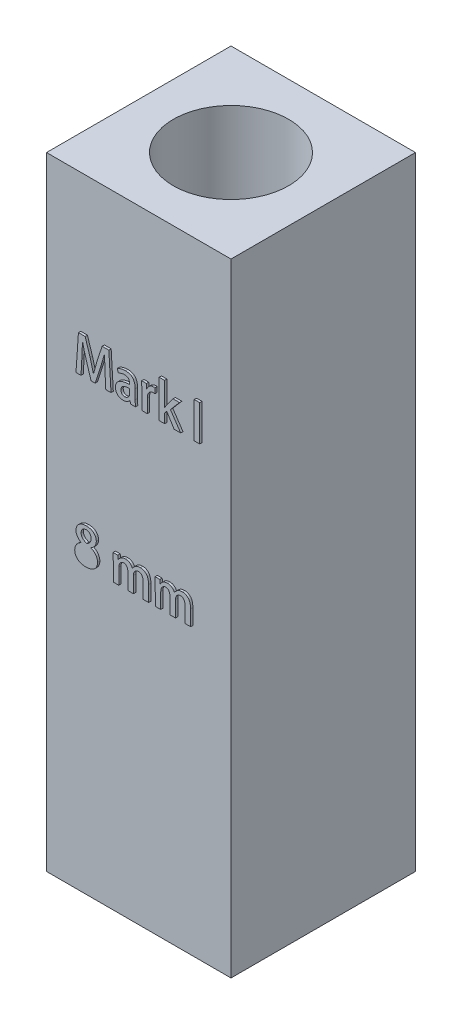
from build123d import *

# Parameters (mm, degrees)
CROQUIS1_W              = 8
CROQUIS1_H              = 8
CROQUIS1_R              = 2.5
SALIENTE_EXTRUIR1_DEPTH = 27
CROQUIS2_2_W            = 0.238171994
CROQUIS2_2_H            = 1.552222223
SALIENTE_EXTRUIR2_DEPTH = 0.1


with BuildPart() as part:
    # Croquis1 → Saliente-Extruir1 (new body)
    with BuildSketch(Plane(origin=(0, 0, 0), x_dir=(1, 0, 0), z_dir=(0, 1, 0))):
        Rectangle(CROQUIS1_W, CROQUIS1_H)
        with Locations(Location((0, 0, 0), (0, 0, 270))):
            Circle(CROQUIS1_R, mode=Mode.SUBTRACT)
    extrude(amount=SALIENTE_EXTRUIR1_DEPTH)

    # Croquis2<2> → Saliente-Extruir2 (add)
    # profile 1 of 8: a face of its own
    with BuildSketch(Plane.XY.offset(4)):
        with BuildLine():
            Line((-1.196299168, 21.029080524), (-1.489029741, 21.029080524))
            Line((-1.489029741, 21.029080524), (-1.713120041, 20.346907093))
            add(Edge.make_bspline(
                [(-1.713120041, 20.346907093), (-1.727697615, 20.299716085), (-1.756231951, 20.207343783), (-1.795341625, 20.070753521), (-1.829992127, 19.939079232), (-1.850660973, 19.852657221), (-1.860771731, 19.810381416)],
                knots=[0, 0, 0, 0, 1.06482216, 2.08429696, 3.06287894, 4, 4, 4, 4], degree=3))
            Line((-1.860771731, 19.810381416), (-1.866551238, 19.810381416))
            add(Edge.make_bspline(
                [(-1.866551238, 19.810381416), (-1.876481422, 19.853051166), (-1.896683618, 19.939859498), (-1.93070374, 20.071488595), (-1.967459767, 20.207101232), (-1.994351955, 20.298408277), (-2.008015817, 20.344801184)],
                knots=[0, 0, 0, 0, 0.950771496, 1.934271678, 2.950408035, 4, 4, 4, 4], degree=3))
            Line((-2.008015817, 20.344801184), (-2.225903251, 21.029080524))
            Line((-2.225903251, 21.029080524), (-2.516614993, 21.029080524))
            Line((-2.516614993, 21.029080524), (-2.621630897, 19.479409339))
            Line((-2.621630897, 19.479409339), (-2.403560427, 19.479409339))
            Line((-2.403560427, 19.479409339), (-2.36924029, 20.115225551))
            add(Edge.make_bspline(
                [(-2.36924029, 20.115225551), (-2.366142688, 20.170919846), (-2.35989255, 20.283296133), (-2.353809897, 20.423803434), (-2.348367501, 20.535729765), (-2.345730048, 20.61699773), (-2.342790327, 20.695298568), (-2.341738393, 20.746445045), (-2.341221555, 20.771574379)],
                knots=[0, 0, 0, 0, 1.528265809, 3.083634274, 3.853229214, 4.59840858, 5.311368824, 6, 6, 6, 6], degree=3))
            Line((-2.341221555, 20.771574379), (-2.334920154, 20.771597581))
            add(Edge.make_bspline(
                [(-2.334920154, 20.771597581), (-2.324589296, 20.723617077), (-2.303631025, 20.626278754), (-2.266531143, 20.479508668), (-2.225758304, 20.329473172), (-2.195122831, 20.22906041), (-2.179605039, 20.178198314)],
                knots=[0, 0, 0, 0, 0.959753872, 1.947058171, 2.960122984, 4, 4, 4, 4], degree=3))
            Line((-2.179605039, 20.178198314), (-1.967492815, 19.493601312))
            Line((-1.967492815, 19.493601312), (-1.791854471, 19.493601312))
            Line((-1.791854471, 19.493601312), (-1.561707676, 20.192452732))
            add(Edge.make_bspline(
                [(-1.561707676, 20.192452732), (-1.545557325, 20.241909213), (-1.513574545, 20.339848618), (-1.469197981, 20.486028271), (-1.427941936, 20.629553544), (-1.402746733, 20.724599981), (-1.390294614, 20.771574379)],
                knots=[0, 0, 0, 0, 1.033513873, 2.046682856, 3.034620343, 4, 4, 4, 4], degree=3))
            Line((-1.390294614, 20.771574379), (-1.384050501, 20.771597581))
            add(Edge.make_bspline(
                [(-1.384050501, 20.771597581), (-1.384147418, 20.746657815), (-1.384345026, 20.695806648), (-1.383338746, 20.618262138), (-1.381707988, 20.538078238), (-1.377545118, 20.428380993), (-1.371719332, 20.291107159), (-1.366485475, 20.18142271), (-1.363896272, 20.12716152)],
                knots=[0, 0, 0, 0, 0.69615936, 1.419440619, 2.164688967, 2.934803833, 4.483639269, 6, 6, 6, 6], degree=3))
            Line((-1.363896272, 20.12716152), (-1.32954205, 19.479409339))
            Line((-1.32954205, 19.479409339), (-1.103432918, 19.479409339))
            Line((-1.103432918, 19.479409339), (-1.196299168, 21.029080524))
        make_face()
    # profile 2 of 8: a face of its own
    with BuildSketch(Plane.XY.offset(4)):
        with BuildLine():
            add(Edge.make_bspline(
                [(-0.053952166, 20.155506797), (-0.053933683, 20.171094279), (-0.053897286, 20.201789221), (-0.057518774, 20.247008773), (-0.063893546, 20.290439821), (-0.073214651, 20.332080632), (-0.085936266, 20.371763587), (-0.101413142, 20.409687835), (-0.120056057, 20.445711117), (-0.141545368, 20.479861857), (-0.167086723, 20.511273005), (-0.197339407, 20.538867014), (-0.232386885, 20.562185402), (-0.272154981, 20.581216365), (-0.316470833, 20.596407), (-0.365308531, 20.607712644), (-0.418720262, 20.615108287), (-0.45586616, 20.61654487), (-0.475152092, 20.617290736)],
                knots=[0, 0, 0, 0, 1.04529413, 2.058397975, 3.039753549, 3.988049356, 4.917306062, 5.832005784, 6.732558164, 7.634995369, 8.534400609, 9.439717093, 10.371077683, 11.347885902, 12.389132223, 13.507522911, 14.705920534, 16, 16, 16, 16], degree=3))
            add(Edge.make_bspline(
                [(-0.475152092, 20.617290736), (-0.492957595, 20.616816764), (-0.528048962, 20.615882654), (-0.579600467, 20.61088989), (-0.629120436, 20.602765232), (-0.676037595, 20.591206125), (-0.720086934, 20.577835591), (-0.760725874, 20.56297161), (-0.797576215, 20.546416367), (-0.820085609, 20.533481991), (-0.830943079, 20.527243058)],
                knots=[0, 0, 0, 0, 1.151566781, 2.269526023, 3.346377101, 4.393757963, 5.391790339, 6.321988655, 7.190606464, 8, 8, 8, 8], degree=3))
            Line((-0.830943079, 20.527243058), (-0.781123083, 20.369063254))
            add(Edge.make_bspline(
                [(-0.781123083, 20.369063254), (-0.77171247, 20.37510656), (-0.75272953, 20.387297021), (-0.722239537, 20.403059962), (-0.690103274, 20.417263833), (-0.656139477, 20.428702506), (-0.621351216, 20.438541683), (-0.585956767, 20.445552861), (-0.550147937, 20.449783122), (-0.526200151, 20.450385225), (-0.514162975, 20.450687867)],
                knots=[0, 0, 0, 0, 0.947728913, 1.911743672, 2.906591377, 3.923705885, 4.947352295, 5.969890554, 6.979580645, 8, 8, 8, 8], degree=3))
            add(Edge.make_bspline(
                [(-0.514162975, 20.450687867), (-0.501813894, 20.449873349), (-0.478242904, 20.448318659), (-0.444972946, 20.442010936), (-0.415449317, 20.43362517), (-0.389446639, 20.42296027), (-0.367418177, 20.408938358), (-0.348994114, 20.39252782), (-0.334418974, 20.373321038), (-0.321472296, 20.344609444), (-0.310378364, 20.308152502), (-0.300596189, 20.265632707), (-0.296081909, 20.224913524), (-0.297364519, 20.198636491), (-0.297989886, 20.185824502)],
                knots=[0, 0, 0, 0, 1.124941475, 2.147203117, 3.073276344, 3.914150165, 4.693859246, 5.436944029, 6.148486199, 6.868538222, 8.288979618, 9.609682438, 10.834544209, 12, 12, 12, 12], degree=3))
            add(Edge.make_bspline(
                [(-0.297989886, 20.185824502), (-0.320678653, 20.185539999), (-0.365025123, 20.184983922), (-0.429782822, 20.180745531), (-0.490876774, 20.172779945), (-0.548357177, 20.161890924), (-0.60242818, 20.148446821), (-0.652727709, 20.130932907), (-0.699627981, 20.11078697), (-0.742785665, 20.087455124), (-0.78181461, 20.060849193), (-0.815831886, 20.03054531), (-0.844514985, 19.996643678), (-0.868702711, 19.959781778), (-0.887106432, 19.919009882), (-0.900985991, 19.875142448), (-0.90956491, 19.827714103), (-0.911105263, 19.794968866), (-0.911897994, 19.778116776)],
                knots=[0, 0, 0, 0, 1.312583045, 2.565517338, 3.751913568, 4.874585872, 5.948775456, 6.97196923, 7.952367169, 8.899011352, 9.80588498, 10.679130641, 11.525793372, 12.368308044, 13.221239438, 14.104974037, 15.024739096, 16, 16, 16, 16], degree=3))
            add(Edge.make_bspline(
                [(-0.911897994, 19.778116776), (-0.911473645, 19.767156476), (-0.910641021, 19.745651047), (-0.906633242, 19.713979761), (-0.899372869, 19.68374055), (-0.890222197, 19.654513549), (-0.877670348, 19.62680416), (-0.862708273, 19.600423672), (-0.845267409, 19.575176501), (-0.825103672, 19.551624148), (-0.802677089, 19.5297669), (-0.777493306, 19.511004679), (-0.750365313, 19.494799783), (-0.721140808, 19.481133874), (-0.689496917, 19.470690929), (-0.655746236, 19.462757034), (-0.61969828, 19.457773568), (-0.594937614, 19.456639732), (-0.582212035, 19.456057004)],
                knots=[0, 0, 0, 0, 1.019558823, 2.000497171, 2.961865832, 3.90763667, 4.843526869, 5.78386522, 6.724423229, 7.691661655, 8.662438953, 9.629634663, 10.603980382, 11.596308817, 12.622532153, 13.696327026, 14.81604254, 16, 16, 16, 16], degree=3))
            add(Edge.make_bspline(
                [(-0.582212035, 19.456057004), (-0.565841961, 19.456612545), (-0.533867175, 19.457697653), (-0.487707844, 19.466370755), (-0.444274735, 19.478668363), (-0.404395551, 19.496746116), (-0.368185088, 19.518848134), (-0.335215096, 19.543532898), (-0.306123182, 19.571455519), (-0.289918348, 19.592526447), (-0.281857566, 19.603007774)],
                knots=[0, 0, 0, 0, 1.130657597, 2.208452709, 3.237069398, 4.244418774, 5.223812689, 6.164576675, 7.087004055, 8, 8, 8, 8], degree=3))
            Line((-0.281857566, 19.603007774), (-0.275253111, 19.603065349))
            Line((-0.275253111, 19.603065349), (-0.258392086, 19.477618228))
            Line((-0.258392086, 19.477618228), (-0.037732768, 19.477618228))
            add(Edge.make_bspline(
                [(-0.037732768, 19.477618228), (-0.040897849, 19.496597162), (-0.047581659, 19.536675639), (-0.051747532, 19.600214154), (-0.05403103, 19.668395576), (-0.054172931, 19.715246615), (-0.054245195, 19.739105893)],
                knots=[0, 0, 0, 0, 0.879539962, 1.857355241, 2.908840502, 4, 4, 4, 4], degree=3))
            Line((-0.054245195, 19.739105893), (-0.053952166, 20.155506797))
        make_face()
        with BuildLine():
            add(Edge.make_bspline(
                [(-0.292123874, 19.85181673), (-0.292565708, 19.843563522), (-0.293425459, 19.827503836), (-0.297118337, 19.804055524), (-0.302157272, 19.781770952), (-0.30974875, 19.760760078), (-0.318698035, 19.74068664), (-0.329992125, 19.721921664), (-0.342912234, 19.704123049), (-0.357899957, 19.687847624), (-0.374138828, 19.672946445), (-0.391614279, 19.660011148), (-0.409781112, 19.64873434), (-0.42910308, 19.639619265), (-0.449388406, 19.632186668), (-0.470747733, 19.627011652), (-0.493045123, 19.623714024), (-0.508187646, 19.623016293), (-0.515922865, 19.622659873)],
                knots=[0, 0, 0, 0, 1.1127689, 2.165305488, 3.194083487, 4.185588777, 5.169981375, 6.15040018, 7.13046498, 8.12816315, 9.12586132, 10.095335325, 11.053196287, 12.001774197, 12.968470205, 13.958837393, 14.957317833, 16, 16, 16, 16], degree=3))
            add(Edge.make_bspline(
                [(-0.515922865, 19.622659873), (-0.526348867, 19.622986841), (-0.54677129, 19.623627305), (-0.576043385, 19.632361798), (-0.60296697, 19.646059855), (-0.627344866, 19.665200397), (-0.647756744, 19.69069521), (-0.66238159, 19.722675436), (-0.671428419, 19.760622731), (-0.672737046, 19.787936502), (-0.673432972, 19.802461914)],
                knots=[0, 0, 0, 0, 0.925162071, 1.812204857, 2.691873356, 3.602553412, 4.549923018, 5.56994314, 6.707700436, 8, 8, 8, 8], degree=3))
            add(Edge.make_bspline(
                [(-0.673432972, 19.802461914), (-0.672504166, 19.814124606), (-0.670710258, 19.836650073), (-0.664133484, 19.868903199), (-0.653394707, 19.897940713), (-0.639623735, 19.923993766), (-0.622452724, 19.947140376), (-0.60120143, 19.966485377), (-0.576944474, 19.983265842), (-0.53961783, 20.000360001), (-0.489300298, 20.016507544), (-0.426242327, 20.030369907), (-0.360162716, 20.037877182), (-0.315313119, 20.037760195), (-0.292416903, 20.037700472)],
                knots=[0, 0, 0, 0, 0.831751151, 1.606454387, 2.332498033, 3.02628555, 3.696675427, 4.370806108, 5.061344671, 5.786088267, 7.281491765, 8.811961156, 10.372470837, 12, 12, 12, 12], degree=3))
            Line((-0.292416903, 20.037700472), (-0.292123874, 19.85181673))
        make_face(mode=Mode.SUBTRACT)
    # profile 3 of 8: a face of its own
    with BuildSketch(Plane.XY.offset(4)):
        with BuildLine():
            add(Edge.make_bspline(
                [(0.798083824, 20.611553336), (0.788539911, 20.613210649), (0.769047446, 20.61659554), (0.749267113, 20.617055819), (0.739171639, 20.617290736)],
                knots=[0, 0, 0, 0, 0.97924127, 2, 2, 2, 2], degree=3))
            add(Edge.make_bspline(
                [(0.739171639, 20.617290736), (0.723847826, 20.616453707), (0.693455305, 20.614793584), (0.648964014, 20.602845287), (0.606665471, 20.583392189), (0.566554279, 20.557213359), (0.529366688, 20.524773207), (0.497456952, 20.485421616), (0.469512451, 20.440761818), (0.456024619, 20.407616391), (0.449083192, 20.39055831)],
                knots=[0, 0, 0, 0, 0.938175605, 1.860732817, 2.801619752, 3.780189859, 4.786007179, 5.811395864, 6.873648904, 8, 8, 8, 8], degree=3))
            Line((0.449083192, 20.39055831), (0.440870375, 20.390609296))
            Line((0.440870375, 20.390609296), (0.432657557, 20.593479237))
            Line((0.432657557, 20.593479237), (0.225386747, 20.593479237))
            add(Edge.make_bspline(
                [(0.225386747, 20.593479237), (0.226735788, 20.567494093), (0.229489608, 20.514450168), (0.231570538, 20.432608946), (0.233218682, 20.345688049), (0.233208637, 20.28584588), (0.233203418, 20.254753506)],
                knots=[0, 0, 0, 0, 0.921405029, 1.880880017, 2.898962507, 4, 4, 4, 4], degree=3))
            Line((0.233203418, 20.254753506), (0.233496446, 19.478268161))
            Line((0.233496446, 19.478268161), (0.47166844, 19.478268161))
            Line((0.47166844, 19.478268161), (0.47166844, 20.070276186))
            add(Edge.make_bspline(
                [(0.47166844, 20.070276186), (0.472033638, 20.082301823), (0.47274468, 20.105715785), (0.475848675, 20.139945871), (0.481442585, 20.172189381), (0.489050183, 20.202603479), (0.498765514, 20.231145838), (0.510353047, 20.258001793), (0.524589729, 20.282599339), (0.540410607, 20.305428882), (0.558265096, 20.325823855), (0.577615533, 20.344024212), (0.599106245, 20.358987052), (0.621896445, 20.371773551), (0.646567142, 20.381305855), (0.672514788, 20.388861822), (0.700215782, 20.393190292), (0.719212277, 20.393972346), (0.728905617, 20.394371404)],
                knots=[0, 0, 0, 0, 1.241840886, 2.417868999, 3.544527356, 4.616704577, 5.650820151, 6.654086497, 7.630544836, 8.5797601, 9.516878827, 10.423948895, 11.314471818, 12.213419717, 13.114913654, 14.038234368, 14.998969914, 16, 16, 16, 16], degree=3))
            add(Edge.make_bspline(
                [(0.728905617, 20.394371404), (0.741154195, 20.394190832), (0.764272582, 20.393850016), (0.787101102, 20.390214468), (0.797834621, 20.388505106)],
                knots=[0, 0, 0, 0, 1.059639438, 2, 2, 2, 2], degree=3))
            Line((0.797834621, 20.388505106), (0.798083824, 20.611553336))
        make_face()
    # profile 4 of 8: a face of its own
    with BuildSketch(Plane.XY.offset(4)):
        with BuildLine():
            Line((1.473955281, 20.134031505), (1.867275682, 20.594647054))
            Line((1.867275682, 20.594647054), (1.589518491, 20.594647054))
            Line((1.589518491, 20.594647054), (1.311761301, 20.221284671))
            add(Edge.make_bspline(
                [(1.311761301, 20.221284671), (1.297091766, 20.200201073), (1.267485244, 20.157649487), (1.240155846, 20.113600536), (1.226367706, 20.091377101)],
                knots=[0, 0, 0, 0, 0.99096644, 2, 2, 2, 2], degree=3))
            Line((1.226367706, 20.091377101), (1.222554612, 20.091419494))
            Line((1.222554612, 20.091419494), (1.222554612, 21.103899887))
            Line((1.222554612, 21.103899887), (0.984382618, 21.103899887))
            Line((0.984382618, 21.103899887), (0.984382618, 19.476589047))
            Line((0.984382618, 19.476589047), (1.222554612, 19.476589047))
            Line((1.222554612, 19.476589047), (1.222554612, 19.878359438))
            Line((1.222554612, 19.878359438), (1.313788726, 19.989962325))
            Line((1.313788726, 19.989962325), (1.634121836, 19.476589047))
            Line((1.634121836, 19.476589047), (1.9179613, 19.476589047))
            Line((1.9179613, 19.476589047), (1.473955281, 20.134031505))
        make_face()
    # profile 5 of 8: a face of its own
    with BuildSketch(Plane.XY.offset(4)):
        with Locations((2.624013114, 20.252700159)):
            Rectangle(CROQUIS2_2_W, CROQUIS2_2_H)
    # profile 6 of 8: a face of its own
    with BuildSketch(Plane.XY.offset(4)):
        with BuildLine():
            add(Edge.make_bspline(
                [(-2.394639528, 13.199331233), (-2.414955274, 13.189018337), (-2.454932169, 13.168724837), (-2.509285512, 13.130160689), (-2.557105641, 13.085746893), (-2.592023333, 13.044425042), (-2.615743668, 13.008430264), (-2.631856462, 12.980298257), (-2.644889174, 12.95038291), (-2.656215164, 12.919412444), (-2.6645641, 12.886842885), (-2.671092983, 12.853069967), (-2.675241545, 12.817868384), (-2.676063787, 12.793925051), (-2.676480499, 12.781790583)],
                knots=[0, 0, 0, 0, 1.536182654, 3.022867703, 4.479788229, 5.93218847, 6.660618843, 7.387463296, 8.117118149, 8.860197009, 9.610884533, 10.383526275, 11.180772015, 12, 12, 12, 12], degree=3))
            add(Edge.make_bspline(
                [(-2.676480499, 12.781790583), (-2.67594582, 12.768084543), (-2.674894551, 12.741136152), (-2.66910299, 12.701646021), (-2.658945142, 12.664032512), (-2.645149225, 12.628120808), (-2.627489755, 12.593788784), (-2.605537571, 12.561555262), (-2.580189911, 12.530730393), (-2.550877622, 12.502140079), (-2.51794657, 12.475809887), (-2.481172087, 12.453002434), (-2.440914246, 12.43359777), (-2.397336816, 12.417408434), (-2.350150294, 12.404933441), (-2.299549443, 12.395659952), (-2.24545843, 12.389344997), (-2.208172402, 12.388176474), (-2.188991117, 12.387575343)],
                knots=[0, 0, 0, 0, 0.935811956, 1.839964444, 2.717343673, 3.589836375, 4.461384255, 5.346118176, 6.246717212, 7.181100374, 8.135781928, 9.119051424, 10.127873935, 11.181545077, 12.287190622, 13.454726226, 14.690618802, 16, 16, 16, 16], degree=3))
            add(Edge.make_bspline(
                [(-2.188991117, 12.387575343), (-2.17088879, 12.387992345), (-2.135574328, 12.388805843), (-2.08389622, 12.394490653), (-2.034907599, 12.403609757), (-1.988337799, 12.415642543), (-1.944704605, 12.432080082), (-1.903528935, 12.451373081), (-1.864770416, 12.47401018), (-1.829035734, 12.500322752), (-1.796827138, 12.53004103), (-1.767963452, 12.562198115), (-1.744202279, 12.597977273), (-1.724033023, 12.636106989), (-1.708614468, 12.677386951), (-1.696636402, 12.721207181), (-1.689793754, 12.768194041), (-1.688226536, 12.800444987), (-1.687422619, 12.816988372)],
                knots=[0, 0, 0, 0, 1.170147295, 2.282752007, 3.356323684, 4.389659228, 5.387613325, 6.365898087, 7.326337787, 8.28457039, 9.228458044, 10.155433524, 11.070524211, 11.997822863, 12.938084774, 13.913199553, 14.929558711, 16, 16, 16, 16], degree=3))
            add(Edge.make_bspline(
                [(-1.687422619, 12.816988372), (-1.687832754, 12.82863536), (-1.688638242, 12.851509528), (-1.692851172, 12.885140884), (-1.699305921, 12.917491136), (-1.707955671, 12.948689103), (-1.719590037, 12.978287194), (-1.733037101, 13.00678212), (-1.749314118, 13.033772966), (-1.773993052, 13.068194312), (-1.809801486, 13.10775807), (-1.858537229, 13.150214475), (-1.913859978, 13.186524412), (-1.954094985, 13.205793688), (-1.974577917, 13.215603336)],
                knots=[0, 0, 0, 0, 0.804090861, 1.579198749, 2.336234151, 3.079671917, 3.810319065, 4.5287088, 5.252057907, 5.98242451, 7.449643848, 8.923135335, 10.433622465, 12, 12, 12, 12], degree=3))
            Line((-1.974577917, 13.215603336), (-1.974323844, 13.221941688))
            add(Edge.make_bspline(
                [(-1.974323844, 13.221941688), (-1.964558425, 13.227432119), (-1.945193169, 13.238319886), (-1.917955547, 13.256442649), (-1.892394534, 13.275315265), (-1.869113126, 13.295150749), (-1.847681929, 13.315777006), (-1.828770493, 13.337524156), (-1.811461131, 13.359891414), (-1.791933144, 13.390887784), (-1.771846997, 13.430586935), (-1.754103932, 13.479456896), (-1.743828279, 13.529212338), (-1.74259429, 13.562647586), (-1.741979192, 13.579313826)],
                knots=[0, 0, 0, 0, 0.898684859, 1.782131668, 2.62317542, 3.44691585, 4.234754347, 5.007486587, 5.757542912, 6.501874005, 7.943932049, 9.318709508, 10.66347537, 12, 12, 12, 12], degree=3))
            add(Edge.make_bspline(
                [(-1.741979192, 13.579313826), (-1.742243694, 13.591254773), (-1.742766149, 13.614841073), (-1.747434416, 13.649590081), (-1.755941194, 13.682968296), (-1.766836137, 13.71537514), (-1.78180799, 13.746458449), (-1.799985416, 13.776249873), (-1.821313286, 13.804977947), (-1.845796471, 13.832278037), (-1.874022371, 13.857185824), (-1.905653693, 13.879484791), (-1.941105466, 13.898177488), (-1.980053074, 13.913728054), (-2.022509583, 13.925986287), (-2.068443266, 13.934980196), (-2.117872404, 13.940817507), (-2.152017788, 13.942273311), (-2.169632333, 13.943024315)],
                knots=[0, 0, 0, 0, 0.908074351, 1.793669578, 2.659464175, 3.524971254, 4.389871038, 5.277587155, 6.175986534, 7.107986984, 8.061576059, 9.033348973, 10.044779507, 11.102637307, 12.218185689, 13.401041104, 14.659277702, 16, 16, 16, 16], degree=3))
            add(Edge.make_bspline(
                [(-2.169632333, 13.943024315), (-2.185585541, 13.942709491), (-2.21689775, 13.942091569), (-2.262662799, 13.936563653), (-2.306280069, 13.92838559), (-2.34791002, 13.917408318), (-2.387173892, 13.902598254), (-2.424400887, 13.885066963), (-2.459205883, 13.864027873), (-2.491722209, 13.840100683), (-2.521394104, 13.813232046), (-2.547413107, 13.783418577), (-2.569458213, 13.750969875), (-2.587941545, 13.716006389), (-2.60209027, 13.678277458), (-2.613179165, 13.638086593), (-2.619848632, 13.595168589), (-2.621222274, 13.565647986), (-2.621923925, 13.550568965)],
                knots=[0, 0, 0, 0, 1.138523799, 2.234641063, 3.286018345, 4.305325333, 5.303647787, 6.277763087, 7.23901431, 8.20229082, 9.155908906, 10.090953262, 11.020248269, 11.950669805, 12.907348454, 13.891143806, 14.922803602, 16, 16, 16, 16], degree=3))
            add(Edge.make_bspline(
                [(-2.621923925, 13.550568965), (-2.621243721, 13.533797449), (-2.619885631, 13.50031159), (-2.608961853, 13.450836097), (-2.590729971, 13.403028403), (-2.566049304, 13.356654444), (-2.534020993, 13.3128422), (-2.494375194, 13.272789513), (-2.448061644, 13.235897424), (-2.412990379, 13.215737305), (-2.394898184, 13.205337314)],
                knots=[0, 0, 0, 0, 0.925661077, 1.848166662, 2.782918432, 3.744426724, 4.741326942, 5.768523235, 6.848849228, 8, 8, 8, 8], degree=3))
            Line((-2.394898184, 13.205337314), (-2.394639528, 13.199331233))
        make_face()
        with BuildLine():
            add(Edge.make_bspline(
                [(-2.177605399, 13.795486342), (-2.168586296, 13.79479511), (-2.150992864, 13.793446734), (-2.125535409, 13.789982566), (-2.102018764, 13.783568125), (-2.080355034, 13.775608085), (-2.060713075, 13.765122927), (-2.042991985, 13.752820495), (-2.027263589, 13.73832928), (-2.009390538, 13.716180564), (-1.991166497, 13.685466923), (-1.975399211, 13.645268847), (-1.966067679, 13.601938243), (-1.965294154, 13.572027059), (-1.964898525, 13.556728578)],
                knots=[0, 0, 0, 0, 0.902520274, 1.760533079, 2.55785305, 3.329585164, 4.058262762, 4.772633721, 5.476675235, 6.18354884, 7.60541551, 9.020037293, 10.475857553, 12, 12, 12, 12], degree=3))
            add(Edge.make_bspline(
                [(-1.964898525, 13.556728578), (-1.965793647, 13.541611453), (-1.967553601, 13.511888774), (-1.978299974, 13.468888636), (-1.995942742, 13.428930753), (-2.019816758, 13.392534546), (-2.04818598, 13.359721321), (-2.080447723, 13.331314881), (-2.116254333, 13.307422479), (-2.142365136, 13.29552692), (-2.155553217, 13.289518694)],
                knots=[0, 0, 0, 0, 1.043154732, 2.05100869, 3.038703531, 4.043505057, 5.043016385, 6.022847289, 7.001376894, 8, 8, 8, 8], degree=3))
            add(Edge.make_bspline(
                [(-2.155553217, 13.289518694), (-2.173100509, 13.29591105), (-2.207049592, 13.308278465), (-2.25419309, 13.332105374), (-2.295474265, 13.360238659), (-2.326020199, 13.3865206), (-2.347027204, 13.409714934), (-2.360593844, 13.428295086), (-2.37208116, 13.448054924), (-2.38161292, 13.469062067), (-2.388716114, 13.491368465), (-2.394573421, 13.514728945), (-2.397604861, 13.539445376), (-2.398337633, 13.556331206), (-2.398711278, 13.564941395)],
                knots=[0, 0, 0, 0, 1.699900238, 3.288829731, 4.795357721, 6.240313735, 6.946517095, 7.641117047, 8.331423118, 9.024880635, 9.737287951, 10.460794085, 11.215149358, 12, 12, 12, 12], degree=3))
            add(Edge.make_bspline(
                [(-2.398711278, 13.564941395), (-2.398175054, 13.579769933), (-2.397124285, 13.608827493), (-2.38638635, 13.650680346), (-2.369393322, 13.689571964), (-2.349868543, 13.719328626), (-2.330343791, 13.740229638), (-2.314255118, 13.754670656), (-2.295723947, 13.766265103), (-2.275751963, 13.776359137), (-2.253791537, 13.784307531), (-2.230078122, 13.790030681), (-2.20456052, 13.793964185), (-2.186952777, 13.794774476), (-2.177605399, 13.795486342)],
                knots=[0, 0, 0, 0, 1.485512345, 2.910965593, 4.303727114, 5.7324185, 6.454505189, 7.170768772, 7.894719601, 8.640676836, 9.413572559, 10.232199113, 11.085602726, 12, 12, 12, 12], degree=3))
        make_face(mode=Mode.SUBTRACT)
    # profile 7 of 8: a face of its own
    with BuildSketch(Plane.XY.offset(4)):
        with BuildLine():
            add(Edge.make_bspline(
                [(0.527984617, 13.090464425), (0.527056308, 13.111077003), (0.52526455, 13.150861952), (0.518714177, 13.208116919), (0.509738832, 13.260791645), (0.496734661, 13.308435454), (0.481111763, 13.351330131), (0.461953129, 13.389270084), (0.439623855, 13.42252538), (0.413953518, 13.450782133), (0.386071345, 13.474285603), (0.357889271, 13.495127157), (0.328760562, 13.512414251), (0.29901512, 13.526724485), (0.268314518, 13.53741003), (0.23677646, 13.544208935), (0.204687958, 13.548726162), (0.183061896, 13.548586131), (0.172193916, 13.54851576)],
                knots=[0, 0, 0, 0, 1.513261231, 2.920790482, 4.225039661, 5.429095985, 6.538902965, 7.568588871, 8.539409605, 9.468669045, 10.358677973, 11.210859535, 12.037483604, 12.839564471, 13.628941055, 14.4154775, 15.203712731, 16, 16, 16, 16], degree=3))
            add(Edge.make_bspline(
                [(0.172193916, 13.54851576), (0.152978187, 13.547757116), (0.115728225, 13.546286475), (0.062204238, 13.535705198), (0.012738789, 13.519457225), (-0.03213289, 13.495943442), (-0.072695064, 13.466676206), (-0.110357301, 13.433531571), (-0.144040283, 13.395010462), (-0.163266718, 13.366489389), (-0.173037734, 13.35199477)],
                knots=[0, 0, 0, 0, 1.108126197, 2.148118191, 3.136426768, 4.10280475, 5.057637098, 6.016626622, 6.992035069, 8, 8, 8, 8], degree=3))
            Line((-0.173037734, 13.35199477), (-0.177094588, 13.352002217))
            add(Edge.make_bspline(
                [(-0.177094588, 13.352002217), (-0.183708941, 13.366707133), (-0.196652854, 13.39548382), (-0.223415866, 13.434177719), (-0.254998289, 13.46783246), (-0.291319927, 13.49650351), (-0.33184713, 13.519473905), (-0.37621998, 13.535897487), (-0.423808602, 13.546591562), (-0.456810047, 13.547864722), (-0.473685518, 13.54851576)],
                knots=[0, 0, 0, 0, 1.020955632, 1.99795227, 2.96752067, 3.938931661, 4.92195175, 5.909051468, 6.930781959, 8, 8, 8, 8], degree=3))
            add(Edge.make_bspline(
                [(-0.473685518, 13.54851576), (-0.493001212, 13.547449292), (-0.529988553, 13.545407129), (-0.582712473, 13.534511912), (-0.629852288, 13.517070985), (-0.670879577, 13.492789433), (-0.706508823, 13.464778075), (-0.737825181, 13.434690478), (-0.765026469, 13.402786337), (-0.779313905, 13.379377136), (-0.786359213, 13.367833775)],
                knots=[0, 0, 0, 0, 1.224631561, 2.345029053, 3.39800305, 4.394808606, 5.352867572, 6.264332918, 7.144121535, 8, 8, 8, 8], degree=3))
            Line((-0.786359213, 13.367833775), (-0.792365294, 13.368050897))
            Line((-0.792365294, 13.368050897), (-0.804901069, 13.525358204))
            Line((-0.804901069, 13.525358204), (-1.013575436, 13.525358204))
            add(Edge.make_bspline(
                [(-1.013575436, 13.525358204), (-1.012608106, 13.502377927), (-1.01063266, 13.455448483), (-1.008505733, 13.39589831), (-1.006733198, 13.345843903), (-1.006415498, 13.305454338), (-1.005578657, 13.262536495), (-1.005697547, 13.233104947), (-1.005758766, 13.217949856)],
                knots=[0, 0, 0, 0, 1.346187736, 2.749133221, 3.487683855, 4.277464658, 5.113020504, 6, 6, 6, 6], degree=3))
            Line((-1.005758766, 13.217949856), (-1.005465737, 12.415331985))
            Line((-1.005465737, 12.415331985), (-0.767293743, 12.415331985))
            Line((-0.767293743, 12.415331985), (-0.767293743, 13.09249185))
            add(Edge.make_bspline(
                [(-0.767293743, 13.09249185), (-0.766753235, 13.103232166), (-0.765702355, 13.124113934), (-0.761791574, 13.154351077), (-0.756497631, 13.182714145), (-0.748359846, 13.208921168), (-0.738789612, 13.233312822), (-0.727351744, 13.255813951), (-0.713809218, 13.276229203), (-0.698203953, 13.294305112), (-0.681519858, 13.3102841), (-0.664500081, 13.324459513), (-0.647089166, 13.336630126), (-0.629176812, 13.346708092), (-0.610656762, 13.354404904), (-0.591688949, 13.359518265), (-0.572492526, 13.363404703), (-0.559451184, 13.363814309), (-0.552880543, 13.364020681)],
                knots=[0, 0, 0, 0, 1.345028047, 2.615059288, 3.812240957, 4.950008049, 6.042686379, 7.08768926, 8.102172383, 9.099996684, 10.068982838, 10.989984122, 11.868914175, 12.723236376, 13.556990843, 14.370301474, 15.178906315, 16, 16, 16, 16], degree=3))
            add(Edge.make_bspline(
                [(-0.552880543, 13.364020681), (-0.545040018, 13.363617765), (-0.529839028, 13.362836603), (-0.507962417, 13.358672907), (-0.48775339, 13.35218983), (-0.469086706, 13.343336594), (-0.452072968, 13.332125134), (-0.436449842, 13.318820156), (-0.423093363, 13.302722765), (-0.406708922, 13.2784282), (-0.390870584, 13.243127456), (-0.376490309, 13.196390913), (-0.36893376, 13.143983411), (-0.36799511, 13.107390927), (-0.36750552, 13.088304665)],
                knots=[0, 0, 0, 0, 0.755950668, 1.465615932, 2.139074498, 2.796588983, 3.449971736, 4.097964407, 4.76639413, 5.458962618, 6.917416126, 8.473425038, 10.160574856, 12, 12, 12, 12], degree=3))
            Line((-0.36750552, 13.088304665), (-0.367212491, 12.415331985))
            Line((-0.367212491, 12.415331985), (-0.129040784, 12.415331985))
            Line((-0.129040784, 12.415331985), (-0.129040784, 13.104656398))
            add(Edge.make_bspline(
                [(-0.129040784, 13.104656398), (-0.128748014, 13.114571964), (-0.128178329, 13.133866112), (-0.124075428, 13.161890797), (-0.118683524, 13.188429555), (-0.111049208, 13.213245523), (-0.101716527, 13.236423752), (-0.090072428, 13.257615396), (-0.076971652, 13.277456637), (-0.061706563, 13.295181398), (-0.045181238, 13.311035697), (-0.028077624, 13.325066276), (-0.010286173, 13.336940192), (0.008051256, 13.346742493), (0.027017771, 13.354409104), (0.046751785, 13.359596926), (0.066848861, 13.363375547), (0.080564332, 13.363805556), (0.087425907, 13.364020681)],
                knots=[0, 0, 0, 0, 1.267233675, 2.465839704, 3.615673463, 4.726804397, 5.780700789, 6.804285049, 7.813184962, 8.815168933, 9.787633234, 10.738404153, 11.639821434, 12.517791614, 13.392909498, 14.248069017, 15.123543946, 16, 16, 16, 16], degree=3))
            add(Edge.make_bspline(
                [(0.087425907, 13.364020681), (0.095943648, 13.363598871), (0.11249021, 13.362779462), (0.136535667, 13.358845879), (0.158516275, 13.351507281), (0.179178626, 13.342725949), (0.197410146, 13.330226053), (0.214391293, 13.315984048), (0.229100108, 13.298535998), (0.242224436, 13.278934345), (0.253645343, 13.257167011), (0.263242321, 13.233402408), (0.271818704, 13.207997405), (0.278543723, 13.180618265), (0.283307715, 13.151460102), (0.287312888, 13.120568649), (0.289234296, 13.087743085), (0.289423101, 13.065232341), (0.289519881, 13.053693505)],
                knots=[0, 0, 0, 0, 0.979325905, 1.902438322, 2.786756391, 3.636233264, 4.470958944, 5.315074409, 6.175027208, 7.081388835, 8.020752095, 8.99258041, 10.022434341, 11.098284182, 12.226320848, 13.414468146, 14.674676153, 16, 16, 16, 16], degree=3))
            Line((0.289519881, 13.053693505), (0.289812623, 12.415331985))
            Line((0.289812623, 12.415331985), (0.527984617, 12.415331985))
            Line((0.527984617, 12.415331985), (0.527984617, 13.090464425))
        make_face()
    # profile 8 of 8: a face of its own
    with BuildSketch(Plane.XY.offset(4)):
        with BuildLine():
            add(Edge.make_bspline(
                [(2.348883584, 13.090464425), (2.347955275, 13.111077003), (2.346163517, 13.150861952), (2.339613144, 13.208116919), (2.330637799, 13.260791645), (2.317633628, 13.308435454), (2.30201073, 13.351330131), (2.282852096, 13.389270084), (2.260522822, 13.42252538), (2.234852485, 13.450782133), (2.206970312, 13.474285603), (2.178788238, 13.495127157), (2.149659529, 13.512414251), (2.119914087, 13.526724485), (2.089213485, 13.53741003), (2.057675427, 13.544208935), (2.025586925, 13.548726162), (2.003960863, 13.548586131), (1.993092883, 13.54851576)],
                knots=[0, 0, 0, 0, 1.513261231, 2.920790482, 4.225039661, 5.429095985, 6.538902965, 7.568588871, 8.539409605, 9.468669045, 10.358677973, 11.210859535, 12.037483604, 12.839564471, 13.628941055, 14.4154775, 15.203712731, 16, 16, 16, 16], degree=3))
            add(Edge.make_bspline(
                [(1.993092883, 13.54851576), (1.973877154, 13.547757116), (1.936627192, 13.546286475), (1.883103205, 13.535705198), (1.833637756, 13.519457225), (1.788766077, 13.495943442), (1.748203903, 13.466676206), (1.710541666, 13.433531571), (1.676858684, 13.395010462), (1.657632249, 13.366489389), (1.647861233, 13.35199477)],
                knots=[0, 0, 0, 0, 1.108126197, 2.148118191, 3.136426768, 4.10280475, 5.057637098, 6.016626622, 6.992035069, 8, 8, 8, 8], degree=3))
            Line((1.647861233, 13.35199477), (1.643804379, 13.352002217))
            add(Edge.make_bspline(
                [(1.643804379, 13.352002217), (1.637190026, 13.366707133), (1.624246113, 13.39548382), (1.597483101, 13.434177719), (1.565900678, 13.46783246), (1.52957904, 13.49650351), (1.489051837, 13.519473905), (1.444678987, 13.535897487), (1.397090365, 13.546591562), (1.36408892, 13.547864722), (1.34721345, 13.54851576)],
                knots=[0, 0, 0, 0, 1.020955632, 1.99795227, 2.96752067, 3.938931661, 4.92195175, 5.909051468, 6.930781959, 8, 8, 8, 8], degree=3))
            add(Edge.make_bspline(
                [(1.34721345, 13.54851576), (1.327897755, 13.547449292), (1.290910414, 13.545407129), (1.238186494, 13.534511912), (1.191046679, 13.517070985), (1.15001939, 13.492789433), (1.114390144, 13.464778075), (1.083073786, 13.434690478), (1.055872498, 13.402786337), (1.041585062, 13.379377136), (1.034539755, 13.367833775)],
                knots=[0, 0, 0, 0, 1.224631561, 2.345029053, 3.39800305, 4.394808606, 5.352867572, 6.264332918, 7.144121535, 8, 8, 8, 8], degree=3))
            Line((1.034539755, 13.367833775), (1.028533673, 13.368050897))
            Line((1.028533673, 13.368050897), (1.015997898, 13.525358204))
            Line((1.015997898, 13.525358204), (0.807323531, 13.525358204))
            add(Edge.make_bspline(
                [(0.807323531, 13.525358204), (0.808290861, 13.502377927), (0.810266307, 13.455448483), (0.812393234, 13.39589831), (0.814165769, 13.345843903), (0.814483469, 13.305454338), (0.81532031, 13.262536495), (0.81520142, 13.233104947), (0.815140201, 13.217949856)],
                knots=[0, 0, 0, 0, 1.346187736, 2.749133221, 3.487683855, 4.277464658, 5.113020504, 6, 6, 6, 6], degree=3))
            Line((0.815140201, 13.217949856), (0.81543323, 12.415331985))
            Line((0.81543323, 12.415331985), (1.053605224, 12.415331985))
            Line((1.053605224, 12.415331985), (1.053605224, 13.09249185))
            add(Edge.make_bspline(
                [(1.053605224, 13.09249185), (1.054145733, 13.103232166), (1.055196612, 13.124113934), (1.059107394, 13.154351077), (1.064401336, 13.182714145), (1.072539121, 13.208921168), (1.082109355, 13.233312822), (1.093547223, 13.255813951), (1.107089749, 13.276229203), (1.122695014, 13.294305112), (1.139379109, 13.3102841), (1.156398886, 13.324459513), (1.173809801, 13.336630126), (1.191722155, 13.346708092), (1.210242205, 13.354404904), (1.229210018, 13.359518265), (1.248406441, 13.363404703), (1.261447783, 13.363814309), (1.268018424, 13.364020681)],
                knots=[0, 0, 0, 0, 1.345028047, 2.615059288, 3.812240957, 4.950008049, 6.042686379, 7.08768926, 8.102172383, 9.099996684, 10.068982838, 10.989984122, 11.868914175, 12.723236376, 13.556990843, 14.370301474, 15.178906315, 16, 16, 16, 16], degree=3))
            add(Edge.make_bspline(
                [(1.268018424, 13.364020681), (1.275858949, 13.363617765), (1.291059939, 13.362836603), (1.31293655, 13.358672907), (1.333145577, 13.35218983), (1.351812261, 13.343336594), (1.368825999, 13.332125134), (1.384449125, 13.318820156), (1.397805604, 13.302722765), (1.414190045, 13.2784282), (1.430028383, 13.243127456), (1.444408658, 13.196390913), (1.451965207, 13.143983411), (1.452903857, 13.107390927), (1.453393447, 13.088304665)],
                knots=[0, 0, 0, 0, 0.755950668, 1.465615932, 2.139074498, 2.796588983, 3.449971736, 4.097964407, 4.76639413, 5.458962618, 6.917416126, 8.473425038, 10.160574856, 12, 12, 12, 12], degree=3))
            Line((1.453393447, 13.088304665), (1.453686476, 12.415331985))
            Line((1.453686476, 12.415331985), (1.691858183, 12.415331985))
            Line((1.691858183, 12.415331985), (1.691858183, 13.104656398))
            add(Edge.make_bspline(
                [(1.691858183, 13.104656398), (1.692150954, 13.114571964), (1.692720638, 13.133866112), (1.696823539, 13.161890797), (1.702215443, 13.188429555), (1.709849759, 13.213245523), (1.71918244, 13.236423752), (1.730826539, 13.257615396), (1.743927315, 13.277456637), (1.759192404, 13.295181398), (1.775717729, 13.311035697), (1.792821343, 13.325066276), (1.810612794, 13.336940192), (1.828950223, 13.346742493), (1.847916738, 13.354409104), (1.867650752, 13.359596926), (1.887747829, 13.363375547), (1.901463299, 13.363805556), (1.908324874, 13.364020681)],
                knots=[0, 0, 0, 0, 1.267233675, 2.465839704, 3.615673463, 4.726804397, 5.780700789, 6.804285049, 7.813184962, 8.815168933, 9.787633234, 10.738404153, 11.639821434, 12.517791614, 13.392909498, 14.248069017, 15.123543946, 16, 16, 16, 16], degree=3))
            add(Edge.make_bspline(
                [(1.908324874, 13.364020681), (1.916842615, 13.363598871), (1.933389177, 13.362779462), (1.957434634, 13.358845879), (1.979415242, 13.351507281), (2.000077593, 13.342725949), (2.018309114, 13.330226053), (2.03529026, 13.315984048), (2.049999076, 13.298535998), (2.063123404, 13.278934345), (2.07454431, 13.257167011), (2.084141289, 13.233402408), (2.092717671, 13.207997405), (2.09944269, 13.180618265), (2.104206682, 13.151460102), (2.108211855, 13.120568649), (2.110133263, 13.087743085), (2.110322068, 13.065232341), (2.110418848, 13.053693505)],
                knots=[0, 0, 0, 0, 0.979325905, 1.902438322, 2.786756391, 3.636233264, 4.470958944, 5.315074409, 6.175027208, 7.081388835, 8.020752095, 8.99258041, 10.022434341, 11.098284182, 12.226320848, 13.414468146, 14.674676153, 16, 16, 16, 16], degree=3))
            Line((2.110418848, 13.053693505), (2.11071159, 12.415331985))
            Line((2.11071159, 12.415331985), (2.348883584, 12.415331985))
            Line((2.348883584, 12.415331985), (2.348883584, 13.090464425))
        make_face()
    extrude(amount=SALIENTE_EXTRUIR2_DEPTH)


solid = part.part
